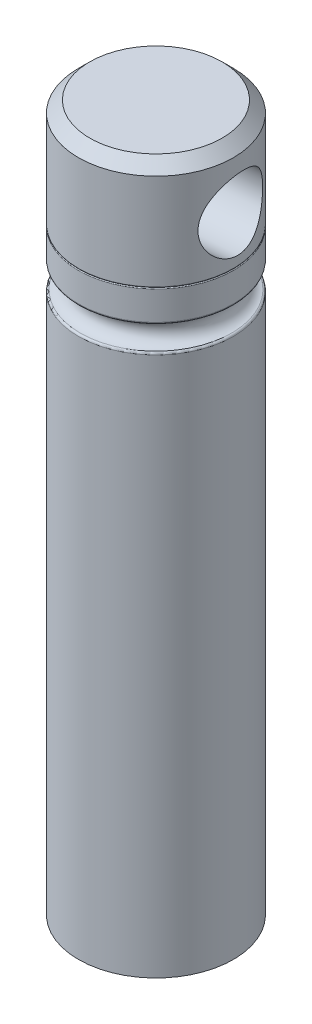
from build123d import *

# Parameters (mm, degrees)
M12_CLEARANCE_HOLE1_D     = 13.0302
M12_CLEARANCE_HOLE1_DEPTH = 29.694674762
CHAMFER2_SIZE             = 2.0828
FILLET1_R                 = 0.381


with BuildPart() as part:
    # Sketch1 → Revolve1 (revolve)
    with BuildSketch(Plane(origin=(0, 0, 75.137205399), x_dir=(-1, 0, 0), z_dir=(0, 0, -1)), mode=Mode.PRIVATE) as revolve1_sk:
        with BuildLine():
            Line((30.344908621, 74.583941634), (44.632408621, 74.583941634))
            Line((44.632408621, 74.583941634), (44.632408621, 204.758941634))
            Line((44.632408621, 204.758941634), (30.344908621, 204.758941634))
            Line((30.344908621, 204.758941634), (30.344908621, 184.997741634))
            ThreePointArc((30.344908621, 184.997741634), (30.396985036, 184.872018048), (30.522708621, 184.819941634))
            ThreePointArc((30.522708621, 184.819941634), (30.396985036, 184.767865219), (30.344908621, 184.642141634))
            Line((30.344908621, 184.642141634), (30.344908621, 178.977941634))
            ThreePointArc((30.344908621, 178.977941634), (32.599158621, 176.723691634), (30.344908621, 174.469441634))
            Line((30.344908621, 174.469441634), (30.344908621, 74.583941634))
        make_face()
    revolve(revolve1_sk.sketch.rotate(Axis((-44.632408621, 74.583941634, 75.137205399), (0, 1, 0)), 270), axis=Axis((-44.632408621, 74.583941634, 75.137205399), (0, 1, 0)))

    # M12 Clearance Hole1
    with Locations(Plane(origin=(-30.392685563, 193.163841634, 73.969753695), x_dir=(0.081711405341, 0, 0.996656032058), z_dir=(0.996656032058, 0, -0.081711405341))):
        with Locations((0, 0)):
            Hole(M12_CLEARANCE_HOLE1_D / 2, depth=M12_CLEARANCE_HOLE1_DEPTH)

    # Chamfer2
    chamfer2_edges = [part.edges().sort_by_distance(p)[0] for p in [
        (-44.632408621, 204.758941634, 60.849705399),
    ]]
    chamfer(chamfer2_edges, length=CHAMFER2_SIZE)

    # Fillet1
    fillet1_edges = [part.edges().sort_by_distance(p)[0] for p in [
        (-44.632408621, 174.469441634, 60.849705399),
        (-44.632408621, 178.977941634, 60.849705399),
    ]]
    fillet(fillet1_edges, radius=FILLET1_R)


solid = part.part
